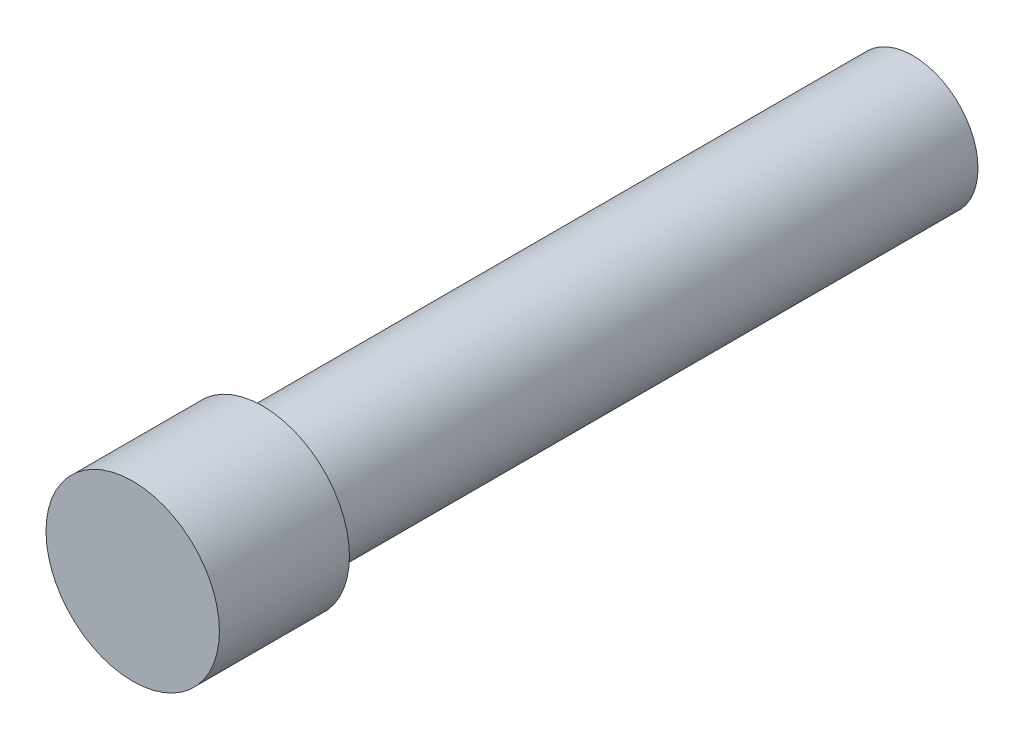
from build123d import *

# Parameters (mm, degrees)
SKETCH1_R           = 1.5
BOSS_EXTRUDE1_DEPTH = 15
SKETCH3_R           = 2
BOSS_EXTRUDE2_DEPTH = 3


with BuildPart() as part:
    # Sketch1 → Boss-Extrude1 (new body)
    with BuildSketch(Plane.XY):
        Circle(SKETCH1_R)
    extrude(amount=BOSS_EXTRUDE1_DEPTH)

    # Sketch3 → Boss-Extrude2 (add)
    with BuildSketch(Plane.XY.offset(15)):
        Circle(SKETCH3_R)
    extrude(amount=BOSS_EXTRUDE2_DEPTH)


solid = part.part
